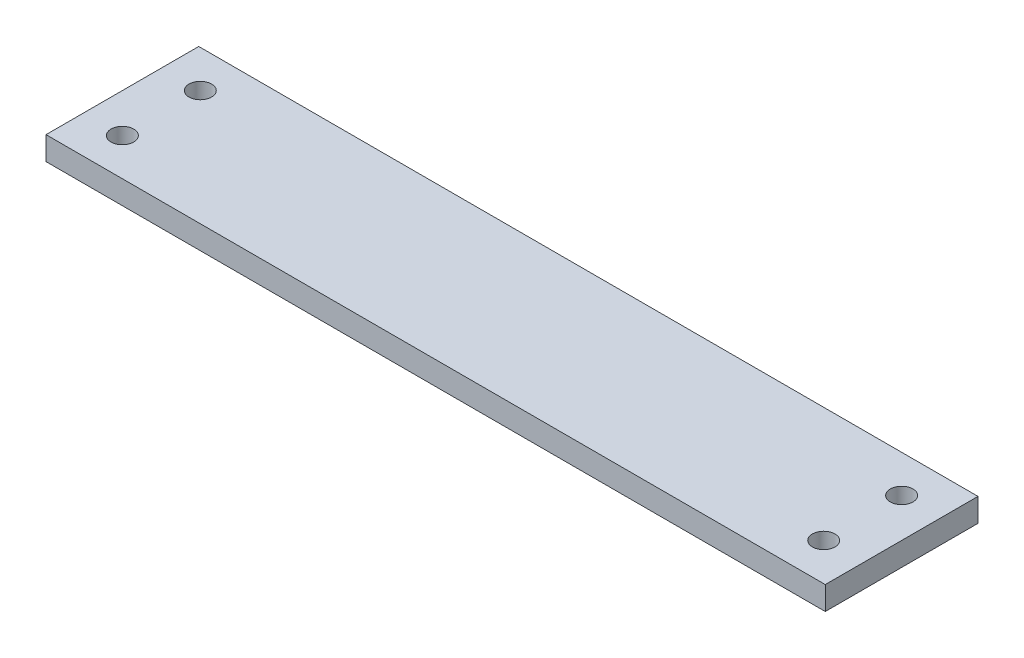
from build123d import *

# Parameters (mm, degrees)
SKETCH_1_W          = 100
SKETCH_1_H          = 20
EXTRUDE_1_DEPTH     = 3
SKETCH_2_R          = 1.45
CUT_EXTRUDE_1_DEPTH = 6
SKETCH_3_W          = 100
SKETCH_3_H          = 3
CUT_EXTRUDE_2_DEPTH = 0.2
SKETCH_5_W          = 100
SKETCH_5_H          = 3
CUT_EXTRUDE_3_DEPTH = 0.2


with BuildPart() as part:
    # 草图1 → 凸台-拉伸1 (new body)
    with BuildSketch(Plane(origin=(0, 0, 0), x_dir=(1, 0, 0), z_dir=(0, 1, 0))):
        with Locations((-50, 10)):
            Rectangle(SKETCH_1_W, SKETCH_1_H)
    extrude(amount=EXTRUDE_1_DEPTH)

    # 草图2 → 切除-拉伸1 (cut)
    with BuildSketch(Plane(origin=(0, 3, 0), x_dir=(1, 0, 0), z_dir=(0, 1, 0))):
        with Locations(Location((-95, 15, 0), (0, 0, 270))):
            Circle(SKETCH_2_R)
        with Locations(Location((-95, 5, 0), (0, 0, 270))):
            Circle(SKETCH_2_R)
        with Locations(Location((-5, 5, 0), (0, 0, 270))):
            Circle(SKETCH_2_R)
        with Locations(Location((-5, 15, 0), (0, 0, 270))):
            Circle(SKETCH_2_R)
    extrude(amount=-CUT_EXTRUDE_1_DEPTH, mode=Mode.SUBTRACT)

    # 草图3 → 切除-拉伸2 (cut)
    with BuildSketch(Plane.XY):
        with Locations((-50, 1.5)):
            Rectangle(SKETCH_3_W, SKETCH_3_H)
    extrude(amount=-CUT_EXTRUDE_2_DEPTH, mode=Mode.SUBTRACT)

    # 草图5 → 切除-拉伸3 (cut)
    with BuildSketch(Plane(origin=(0, 0, -20), x_dir=(-1, 0, 0), z_dir=(0, 0, -1))):
        with Locations((50, 1.5)):
            Rectangle(SKETCH_5_W, SKETCH_5_H)
    extrude(amount=-CUT_EXTRUDE_3_DEPTH, mode=Mode.SUBTRACT)


solid = part.part
